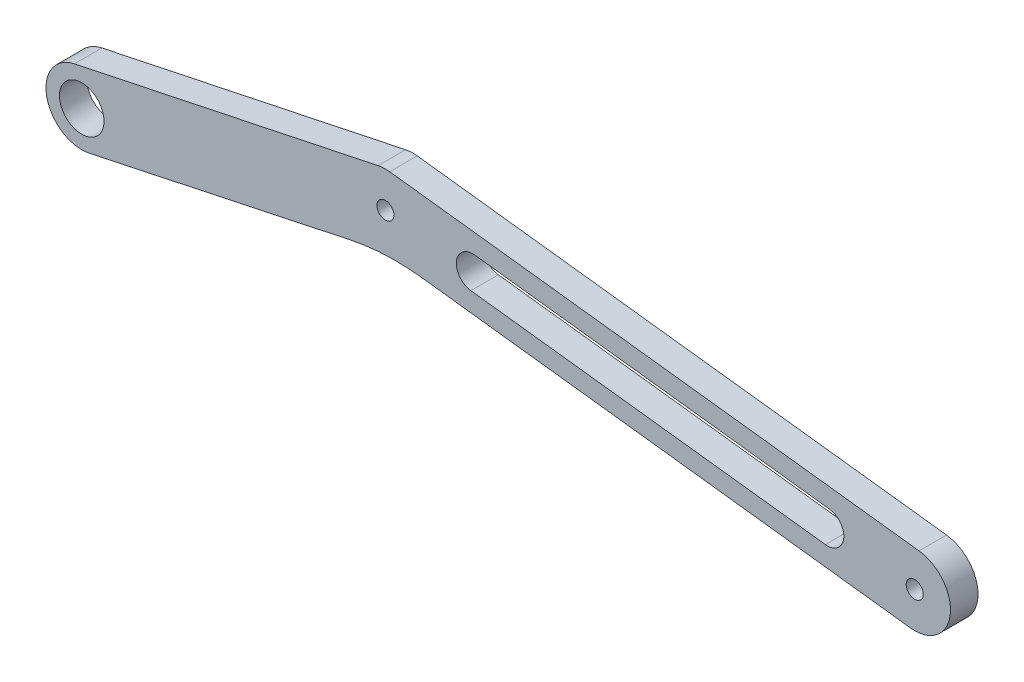
from build123d import *

# Parameters (mm, degrees)
SKETCH_1_R          = 6.5
SKETCH_1_R_2        = 4.05
SKETCH_1_R_3        = 1.55
EXTRUDE_1_DEPTH     = 5
FILLET_1_R          = 40
CUT_EXTRUDE_1_DEPTH = 160.010002676


with BuildPart() as part:
    # 草图1 → 凸台-拉伸1 (new body)
    # profile 1 of 5: a face of its own
    with BuildSketch(Plane.XY):
        Circle(SKETCH_1_R)
        Circle(SKETCH_1_R_2, mode=Mode.SUBTRACT)
    # profile 2 of 5: a face of its own
    with BuildSketch(Plane.XY):
        with BuildLine():
            ThreePointArc((6.5, 0), (5.051052449, -4.091071884), (1.350194104, -6.358221126))
            Line((1.350194104, -6.358221126), (55.199071912, 5.076806988))
            ThreePointArc((55.199071912, 5.076806988), (48.73376571, 10.906123973), (53.864865433, 17.938402155))
            Line((53.864865433, 17.938402155), (-1.334206479, 6.361595167))
            ThreePointArc((-1.334206479, 6.361595167), (4.09741735, 5.045906366), (6.5, 0))
        make_face()
    # profile 3 of 5: a face of its own
    with BuildSketch(Plane.XY):
        with Locations((55.199071912, 11.576806988)):
            Circle(SKETCH_1_R)
        with Locations((55.199071912, 11.576806988)):
            Circle(SKETCH_1_R_3, mode=Mode.SUBTRACT)
    # profile 4 of 5: a face of its own
    with BuildSketch(Plane.XY):
        with BuildLine():
            ThreePointArc((61.699071912, 11.576806988), (59.79526599, 6.98061291), (55.199071912, 5.076806988))
            Line((55.199071912, 5.076806988), (150.620267879, -6.45306267))
            ThreePointArc((150.620267879, -6.45306267), (144.946748663, 0.778169119), (152.176606073, 6.453439626))
            Line((152.176606073, 6.453439626), (55.975677985, 18.030246614))
            ThreePointArc((55.975677985, 18.030246614), (60.062092551, 15.88969816), (61.699071912, 11.576806988))
        make_face()
    # profile 5 of 5: a face of its own
    with BuildSketch(Plane.XY):
        with Locations((151.4, 0)):
            Circle(SKETCH_1_R)
        with Locations((151.4, 0)):
            Circle(SKETCH_1_R_3, mode=Mode.SUBTRACT)
    extrude(amount=EXTRUDE_1_DEPTH)

    # 圆角1
    fillet_1_edges = [part.edges().sort_by_distance(p)[0] for p in [
        (55.199071912, 5.076806988, 2.5),
    ]]
    fillet(fillet_1_edges, radius=FILLET_1_R)

    # 草图2 → 切除-拉伸1 (cut, through all)
    with BuildSketch(Plane.XY.offset(5)):
        with BuildLine():
            Line((71.442895333, 12.643671867), (135.873043723, 4.890156314))
            ThreePointArc((135.873043723, 4.890156314), (138.493120748, 1.553212146), (135.156176579, -1.066864879))
            Line((135.156176579, -1.066864879), (70.726028189, 6.686650674))
            ThreePointArc((70.726028189, 6.686650674), (68.105951164, 10.023594842), (71.442895333, 12.643671867))
        make_face()
    extrude(amount=-CUT_EXTRUDE_1_DEPTH, mode=Mode.SUBTRACT)


solid = part.part
